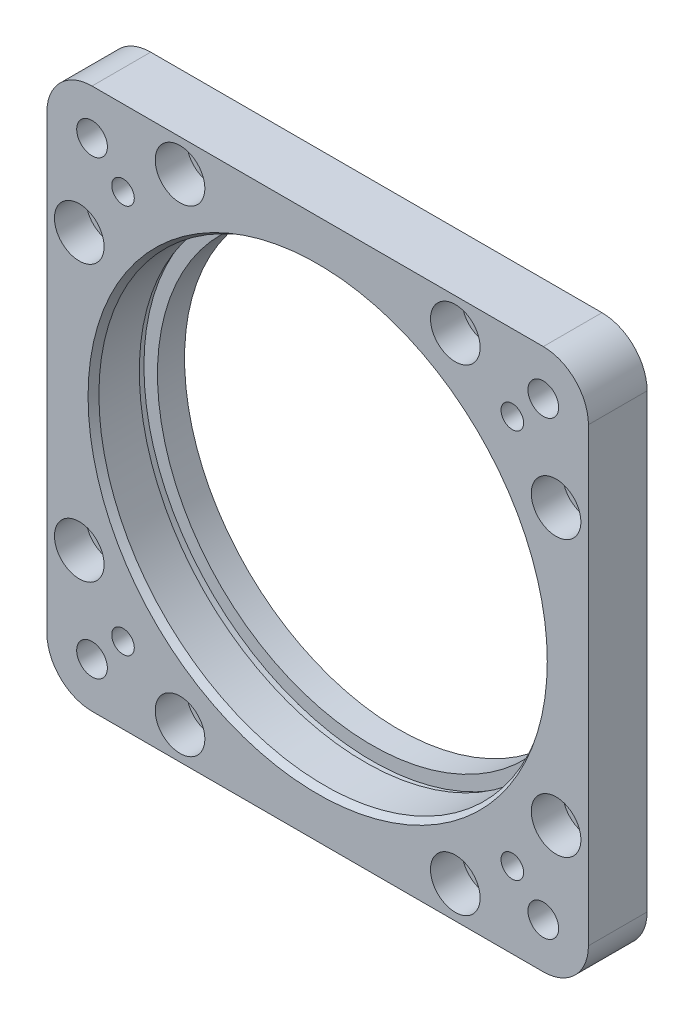
from build123d import *

# Parameters (mm, degrees)
SKETCH1_W                                           = 120
SKETCH1_H                                           = 120
SKETCH1_R                                           = 47.5
BOSS_EXTRUDE1_DEPTH                                 = 18
SKETCH5_OUTSIDE_W                                   = 156.132
SKETCH5_OUTSIDE_H                                   = 156.132
SKETCH5_OUTSIDE_R                                   = 55
CUT_EXTRUDE1_DEPTH                                  = 5
SKETCH12_R                                          = 50
CUT_EXTRUDE2_DEPTH                                  = 12
CBORE_FOR_M6_HEX_SOCKET_HEAD_CAP_SCREW1_D           = 6.6
CBORE_FOR_M6_HEX_SOCKET_HEAD_CAP_SCREW1_CBORE_D     = 11
CBORE_FOR_M6_HEX_SOCKET_HEAD_CAP_SCREW1_CBORE_DEPTH = 7
CIRPATTERN1_COUNT                                   = 4
FILLET1_R                                           = 10
FILLET2_R                                           = 0.38
CHAMFER1_SIZE                                       = 0.7
M6_TAPPED_HOLE1_D                                   = 5
M8_TAPPED_HOLE1_D                                   = 6.8
M8_TAPPED_HOLE1_DEPTH                               = 32.99
M8_TAPPED_HOLE1_TIP                                 = 2.042926105
CHAMFER2_SIZE                                       = 1.524
CHAMFER2_SIZE2                                      = 0.87988181
SKETCH13_R                                          = 50.5
CUT_EXTRUDE3_DEPTH                                  = 1.524


with BuildPart() as part:
    # Sketch1 → Boss-Extrude1 (new body)
    with BuildSketch(Plane.XY):
        Rectangle(SKETCH1_W, SKETCH1_H)
        Circle(SKETCH1_R, mode=Mode.SUBTRACT)
    extrude(amount=-BOSS_EXTRUDE1_DEPTH)

    # Sketch5 outside → Cut-Extrude1 (cut)
    with BuildSketch(Plane(origin=(0, 0, -18), x_dir=(-1, 0, 0), z_dir=(0, 0, -1))):
        Rectangle(SKETCH5_OUTSIDE_W, SKETCH5_OUTSIDE_H)
        Circle(SKETCH5_OUTSIDE_R, mode=Mode.SUBTRACT)
    extrude(amount=-CUT_EXTRUDE1_DEPTH, mode=Mode.SUBTRACT)

    # Sketch12 → Cut-Extrude2 (cut)
    with BuildSketch(Plane.XY):
        Circle(SKETCH12_R)
    extrude(amount=-CUT_EXTRUDE2_DEPTH, mode=Mode.SUBTRACT)

    # CBORE for M6 Hex Socket Head Cap Screw1 (through all)
    with Locations(Plane.XY):
        with Locations((-52.827549631, 30.5), (-30.5, 52.827549631)):
            cbore_for_m6_hex_socket_head_cap_screw1 = CounterBoreHole(CBORE_FOR_M6_HEX_SOCKET_HEAD_CAP_SCREW1_D / 2, CBORE_FOR_M6_HEX_SOCKET_HEAD_CAP_SCREW1_CBORE_D / 2, CBORE_FOR_M6_HEX_SOCKET_HEAD_CAP_SCREW1_CBORE_DEPTH)

    # CirPattern1: CBORE for M6 Hex Socket Head Cap Screw1 ×4 about axis
    cirpattern1_axis = Axis((0, 0, 0), (0, 0, 1))
    for i in range(1, CIRPATTERN1_COUNT):
        add(cbore_for_m6_hex_socket_head_cap_screw1.rotate(cirpattern1_axis, i * 360 / CIRPATTERN1_COUNT), mode=Mode.SUBTRACT)

    # Fillet1
    fillet1_edges = [part.edges().sort_by_distance(p)[0] for p in [
        (-60, -60, -6.5),
        (60, -60, -6.5),
        (60, 60, -6.5),
        (-60, 60, -6.5),
    ]]
    fillet(fillet1_edges, radius=FILLET1_R)

    # Fillet2
    fillet2_edges = [part.edges().sort_by_distance(p)[0] for p in [
        (55, 0, -13),
    ]]
    fillet(fillet2_edges, radius=FILLET2_R)

    # Chamfer1
    chamfer1_edges = [part.edges().sort_by_distance(p)[0] for p in [
        (55, 0, -18),
    ]]
    chamfer(chamfer1_edges, length=CHAMFER1_SIZE)

    # M6 Tapped Hole1 (through all)
    with Locations(Plane.XY):
        with Locations((-43.133513652, -43.133513652), (-43.133513652, 43.133513652), (43.133513652, 43.133513652), (43.133513652, -43.133513652)):
            Hole(M6_TAPPED_HOLE1_D / 2)

    # M8 Tapped Hole1
    with Locations(Plane.XY):
        with Locations((-50, 50), (50, 50), (50, -50), (-50, -50)):
            Hole(M8_TAPPED_HOLE1_D / 2, depth=M8_TAPPED_HOLE1_DEPTH)
            with Locations((0, 0, -(M8_TAPPED_HOLE1_DEPTH + M8_TAPPED_HOLE1_TIP / 2))):  # 118° drill point
                Cone(0, M8_TAPPED_HOLE1_D / 2, M8_TAPPED_HOLE1_TIP, mode=Mode.SUBTRACT)

    # Chamfer2
    chamfer2_edges = [part.edges().sort_by_distance(p)[0] for p in [
        (-50, 0, 0),
    ]]
    chamfer2_side = [part.faces().sort_by_distance(p)[0] for p in [
        (-50, 0, -6),
    ]]
    chamfer(chamfer2_edges, length=CHAMFER2_SIZE, length2=CHAMFER2_SIZE2, reference=chamfer2_side[0])

    # Sketch13 → Cut-Extrude3 (cut)
    with BuildSketch(Plane.XY.offset(-12)):
        with Locations(Location((0, 0, 0), (0, 0, 180))):
            Circle(SKETCH13_R)
    extrude(amount=CUT_EXTRUDE3_DEPTH, mode=Mode.SUBTRACT)


solid = part.part
